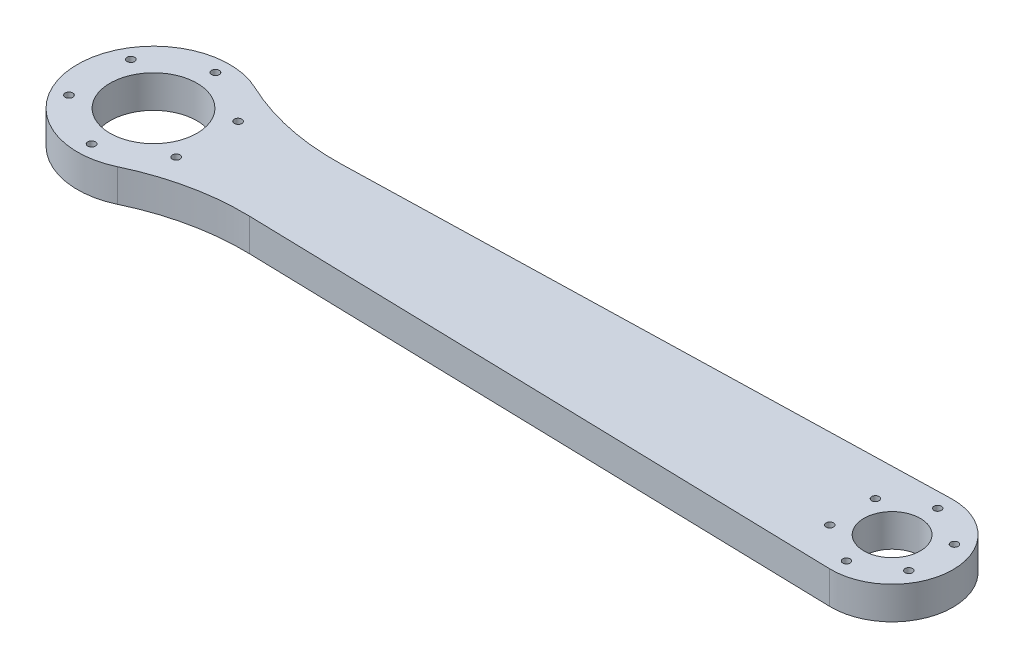
from build123d import *

# Parameters (mm, degrees)
SKETCH_1_R      = 20
SKETCH_1_R_2    = 13
SKETCH_1_R_3    = 1.7
SKETCH_1_R_4    = 1.75
EXTRUDE_1_DEPTH = 15


with BuildPart() as part:
    # 草图1 → 凸台-拉伸1 (new body)
    with BuildSketch(Plane(origin=(0, 0, 0), x_dir=(1, 0, 0), z_dir=(0, 1, 0))):
        with BuildLine():
            Line((65.196415688, 20.938478113), (339.27978891, 27.990735896))
            ThreePointArc((339.27978891, 27.990735896), (368, 0), (339.27978891, -27.990735896))
            Line((339.27978891, -27.990735896), (65.196415688, -20.938478113))
            ThreePointArc((65.196415688, -20.938478113), (39.495702891, -23.306065445), (15.054107063, -31.597054618))
            ThreePointArc((15.054107063, -31.597054618), (-35, 0), (15.054107063, 31.597054618))
            ThreePointArc((15.054107063, 31.597054618), (39.495702891, 23.306065445), (65.196415688, 20.938478113))
        make_face()
        with Locations(Location((0, 0, 0), (0, 0, 270))):
            Circle(SKETCH_1_R, mode=Mode.SUBTRACT)
        with Locations(Location((340, 0, 0), (0, 0, 270))):
            Circle(SKETCH_1_R_2, mode=Mode.SUBTRACT)
        with Locations(Location((340, 21, 0), (0, 0, 270))):
            Circle(SKETCH_1_R_3, mode=Mode.SUBTRACT)
        with Locations(Location((358.186533479, 10.5, 0), (0, 0, 270))):
            Circle(SKETCH_1_R_3, mode=Mode.SUBTRACT)
        with Locations(Location((358.186533479, -10.5, 0), (0, 0, 270))):
            Circle(SKETCH_1_R_3, mode=Mode.SUBTRACT)
        with Locations(Location((340, -21, 0), (0, 0, 270))):
            Circle(SKETCH_1_R_3, mode=Mode.SUBTRACT)
        with Locations(Location((321.813466521, -10.5, 0), (0, 0, 270))):
            Circle(SKETCH_1_R_3, mode=Mode.SUBTRACT)
        with Locations(Location((321.813466521, 10.5, 0), (0, 0, 270))):
            Circle(SKETCH_1_R_3, mode=Mode.SUBTRACT)
        with Locations(Location((0, 28.5, 0), (0, 0, 270))):
            Circle(SKETCH_1_R_4, mode=Mode.SUBTRACT)
        with Locations(Location((-24.681724008, 14.25, 0), (0, 0, 270))):
            Circle(SKETCH_1_R_4, mode=Mode.SUBTRACT)
        with Locations(Location((-24.681724008, -14.25, 0), (0, 0, 270))):
            Circle(SKETCH_1_R_4, mode=Mode.SUBTRACT)
        with Locations(Location((0, -28.5, 0), (0, 0, 270))):
            Circle(SKETCH_1_R_4, mode=Mode.SUBTRACT)
        with Locations(Location((24.681724008, -14.25, 0), (0, 0, 270))):
            Circle(SKETCH_1_R_4, mode=Mode.SUBTRACT)
        with Locations(Location((24.681724008, 14.25, 0), (0, 0, 270))):
            Circle(SKETCH_1_R_4, mode=Mode.SUBTRACT)
    extrude(amount=EXTRUDE_1_DEPTH)


solid = part.part
